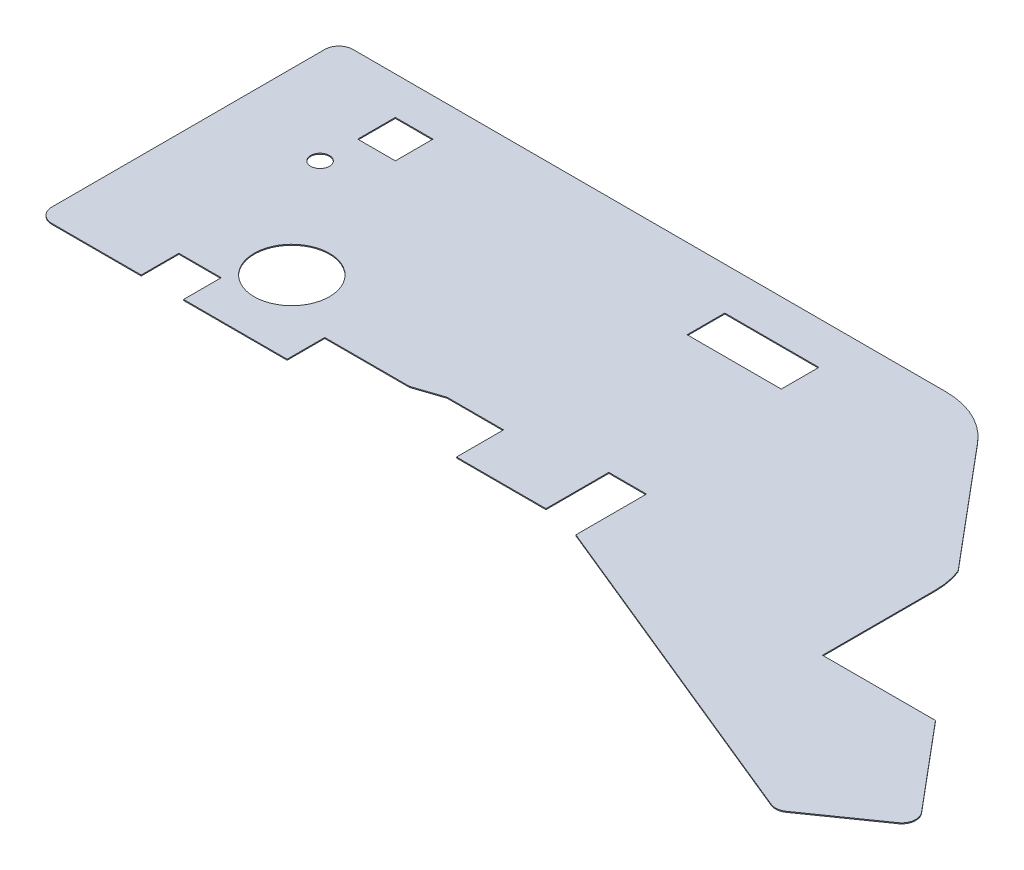
from build123d import *

# Parameters (mm, degrees)
BOSS_EXTRUDE1_DEPTH = 0.635
FILLET1_R           = 9.525
SKETCH2_R           = 25.4
SKETCH2_R_2         = 6.35
SKETCH2_W           = 25.4
SKETCH2_H           = 25.4
SKETCH2_W_2         = 63.5
SKETCH2_H_2         = 47.625
SKETCH2_W_3         = 28.575
CUT_EXTRUDE1_DEPTH  = 390.952780599


with BuildPart() as part:
    # Sketch1 → Boss-Extrude1 (new body)
    with BuildSketch(Plane(origin=(0, 0, 0), x_dir=(1, 0, 0), z_dir=(0, 1, 0))):
        with BuildLine():
            Line((-289.73775964, -52.172972973), (-289.73775964, 151.027027027))
            Line((-289.73775964, 151.027027027), (119.83724036, 151.027027027))
            ThreePointArc((119.83724036, 151.027027027), (141.932070827, 146.12872104), (159.886674172, 132.351669336))
            Line((159.886674172, 132.351669336), (363.971740247, -110.867441355))
            Line((363.971740247, -110.867441355), (306.753969954, -150.931755434))
            Line((306.753969954, -150.931755434), (65.86224036, -52.172972973))
            Line((65.86224036, -52.172972973), (-289.73775964, -52.172972973))
        make_face()
    extrude(amount=BOSS_EXTRUDE1_DEPTH)

    # Fillet1
    fillet1_edges = [part.edges().sort_by_distance(p)[0] for p in [
        (-289.73775964, 0.3175, 52.172972973),
        (-289.73775964, 0.3175, -151.027027027),
        (363.971740247, 0.3175, 110.867441355),
        (306.753969954, 0.3175, 150.931755434),
    ]]
    fillet(fillet1_edges, radius=FILLET1_R)

    # Sketch2 → Cut-Extrude1 (cut, through all)
    with BuildSketch(Plane(origin=(0, 0.635, 0), x_dir=(1, 0, 0), z_dir=(0, 1, 0))):
        with Locations(Location((-169.08775964, -1.372972973, 0), (0, 0, 270))):
            Circle(SKETCH2_R)
        with Locations(Location((-226.23775964, 74.827027027, 0), (0, 0, 270))):
            Circle(SKETCH2_R_2)
        with BuildLine():
            Line((232.109731363, 31.667957705), (232.109731363, -44.532042295))
            Line((232.109731363, -44.532042295), (308.309731363, -44.532042295))
            Line((308.309731363, -44.532042295), (228.651141857, 50.401367929))
            ThreePointArc((228.651141857, 50.401367929), (231.237839047, 41.192957705), (232.109731363, 31.667957705))
        make_face()
        Polygon((-121.46275964, -52.172972973), (-121.46275964, -26.772972973), (-64.31275964, -26.772972973), (-45.26275964, -20.422972973), (-7.16275964, -20.422972973), (-7.16275964, -52.172972973), align=None)
        with Locations((-213.53775964, 112.927027027)):
            Rectangle(SKETCH2_W, SKETCH2_H)
        with Locations((30.93724036, 109.752027027)):
            Rectangle(SKETCH2_W_2, SKETCH2_H)
        with Locations((65.86224036, -33.567113065)):
            Rectangle(SKETCH2_W, SKETCH2_H_2)
        with Locations((-205.60025964, -39.472972973)):
            Rectangle(SKETCH2_W_3, SKETCH2_H)
    extrude(amount=-CUT_EXTRUDE1_DEPTH, mode=Mode.SUBTRACT)


solid = part.part
